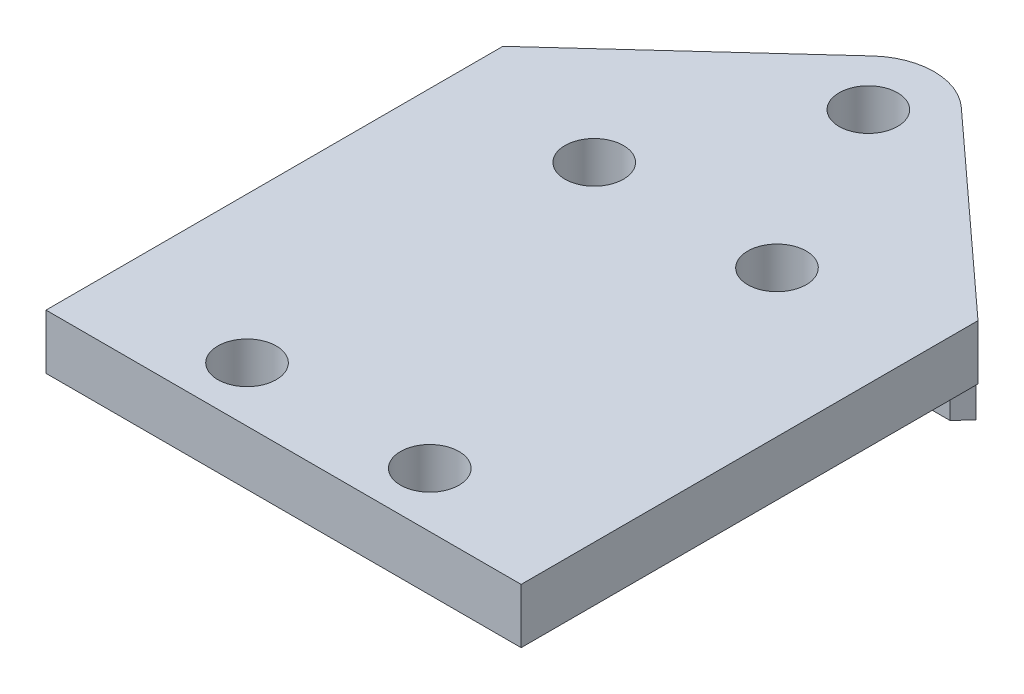
from build123d import *
from build123d.topology import SkipClean

# Parameters (mm, degrees)
SKETCH_2_R      = 1.6
EXTRUDE_1_DEPTH = 3
EXTRUDE_START   = 3
SKETCH_3_R      = 1.6
EXTRUDE_2_DEPTH = 3
EXTRUDE_START_2 = 5
SKETCH_4_R      = 1.6
EXTRUDE_3_DEPTH = 5


with BuildPart() as part:
    # 草图2 → 凸台-拉伸1 (new body)
    with BuildSketch(Plane(origin=(0, 0, 0), x_dir=(1, 0, 0), z_dir=(0, 1, 0))):
        with BuildLine():
            Line((0, 0), (26, 0))
            Line((26, 0), (26, 25))
            Line((26, 25), (15.428093073, 34.657887136))
            ThreePointArc((15.428093073, 34.657887136), (13, 35.6), (10.571906927, 34.657887136))
            Line((10.571906927, 34.657887136), (0, 25))
            Line((0, 25), (0, 0))
        make_face()
        with Locations(Location((8, 22, 0), (0, 0, 270))):
            Circle(SKETCH_2_R, mode=Mode.SUBTRACT)
        with Locations(Location((18, 22, 0), (0, 0, 90))):
            Circle(SKETCH_2_R, mode=Mode.SUBTRACT)
        with Locations(Location((18, 3, 0), (0, 0, 270))):
            Circle(SKETCH_2_R, mode=Mode.SUBTRACT)
        with Locations(Location((8, 3, 0), (0, 0, 90))):
            Circle(SKETCH_2_R, mode=Mode.SUBTRACT)
        with Locations(Location((13, 32, 0), (0, 0, 270))):
            Circle(SKETCH_2_R, mode=Mode.SUBTRACT)
    extrude(amount=EXTRUDE_1_DEPTH)

    # 草图3 → 凸台-拉伸2 (add)
    with SkipClean():  # the faces are left unmerged after this step: merging them gives an invalid solid
        with BuildSketch(Plane.XZ.offset(EXTRUDE_START)):
            with BuildLine():
                Line((2.02996484, -25.5), (23.97003516, -25.5))
                Line((23.97003516, -25.5), (24.644505458, -26.238301982))
                Line((24.644505458, -26.238301982), (15.428093073, -34.657887136))
                ThreePointArc((15.428093073, -34.657887136), (13, -35.6), (10.571906927, -34.657887136))
                Line((10.571906927, -34.657887136), (1.355494542, -26.238301982))
                Line((1.355494542, -26.238301982), (2.02996484, -25.5))
            make_face()
            with Locations(Location((13, -32, 0), (0, 0, 270))):
                Circle(SKETCH_3_R, mode=Mode.SUBTRACT)
        extrude(amount=-EXTRUDE_2_DEPTH)

    # 草图4 → 凸台-拉伸3 (add)
    with SkipClean():  # the faces are left unmerged after this step: merging them gives an invalid solid
        with BuildSketch(Plane.XZ.offset(3).offset(EXTRUDE_START_2)):
            with BuildLine():
                Line((9.6737238, -33.837358605), (10.571906927, -34.657887136))
                ThreePointArc((10.571906927, -34.657887136), (13, -35.6), (15.428093073, -34.657887136))
                Line((15.428093073, -34.657887136), (16.3262762, -33.837358605))
                ThreePointArc((16.3262762, -33.837358605), (14.7315968, -28.61746064), (9.564559196, -30.37588594))
                ThreePointArc((9.564559196, -30.37588594), (9.201888303, -32.119781203), (9.6737238, -33.837358605))
            make_face()
            with Locations(Location((13, -32, 0), (0, 0, 270))):
                Circle(SKETCH_4_R, mode=Mode.SUBTRACT)
        extrude(amount=-EXTRUDE_3_DEPTH)


solid = part.part
